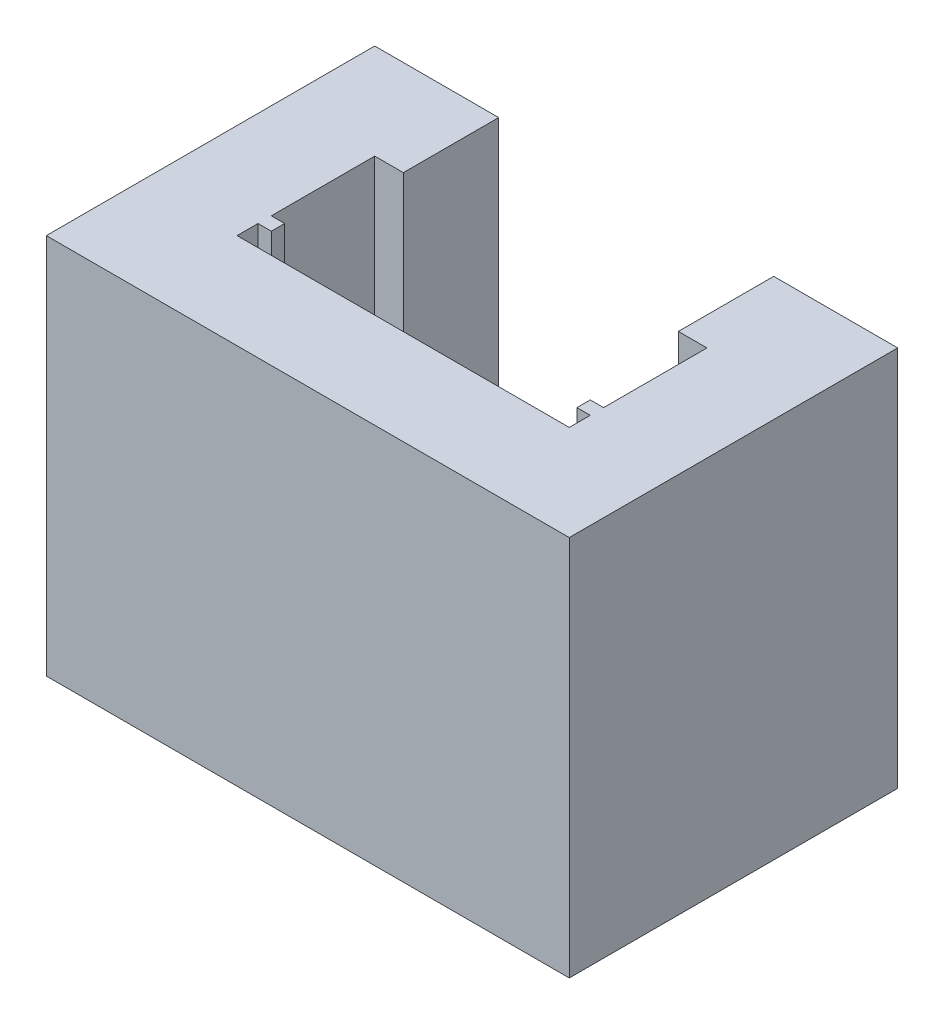
from build123d import *

# Parameters (mm, degrees)
BOSS_EXTRUDE1_DEPTH = 20


with BuildPart() as part:
    # Sketch1 → Boss-Extrude1 (new body)
    with BuildSketch(Plane(origin=(0, 0, 0), x_dir=(1, 0, 0), z_dir=(0, 1, 0))):
        Polygon((-8.71, 0), (8.71, 0), (8.71, 1.1), (8.01, 1.1), (8.01, 1.8), (8.71, 1.8), (8.71, 7.22), (7.21, 7.22), (7.21, 12.22), (13.71, 12.22), (13.71, -5), (-13.71, -5), (-13.71, 12.22), (-7.21, 12.22), (-7.21, 7.22), (-8.71, 7.22), (-8.71, 1.8), (-8.01, 1.8), (-8.01, 1.1), (-8.71, 1.1), align=None)
    extrude(amount=BOSS_EXTRUDE1_DEPTH)


solid = part.part
